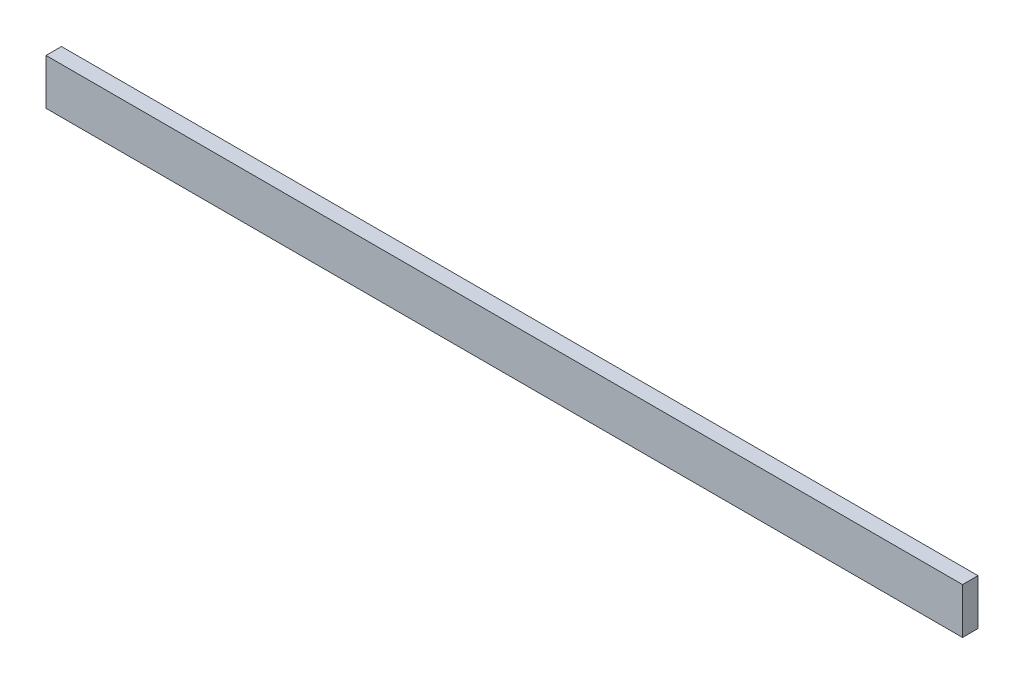
from build123d import *

# Parameters (mm, degrees)
ESQUISSE1_W        = 1600
ESQUISSE1_H        = 80
BOSS_EXTRU_1_DEPTH = 27


with BuildPart() as part:
    # Esquisse1 → Boss.-Extru.1 (new body)
    with BuildSketch(Plane.XY):
        with Locations((800, 40)):
            Rectangle(ESQUISSE1_W, ESQUISSE1_H)
    extrude(amount=BOSS_EXTRU_1_DEPTH)


solid = part.part
